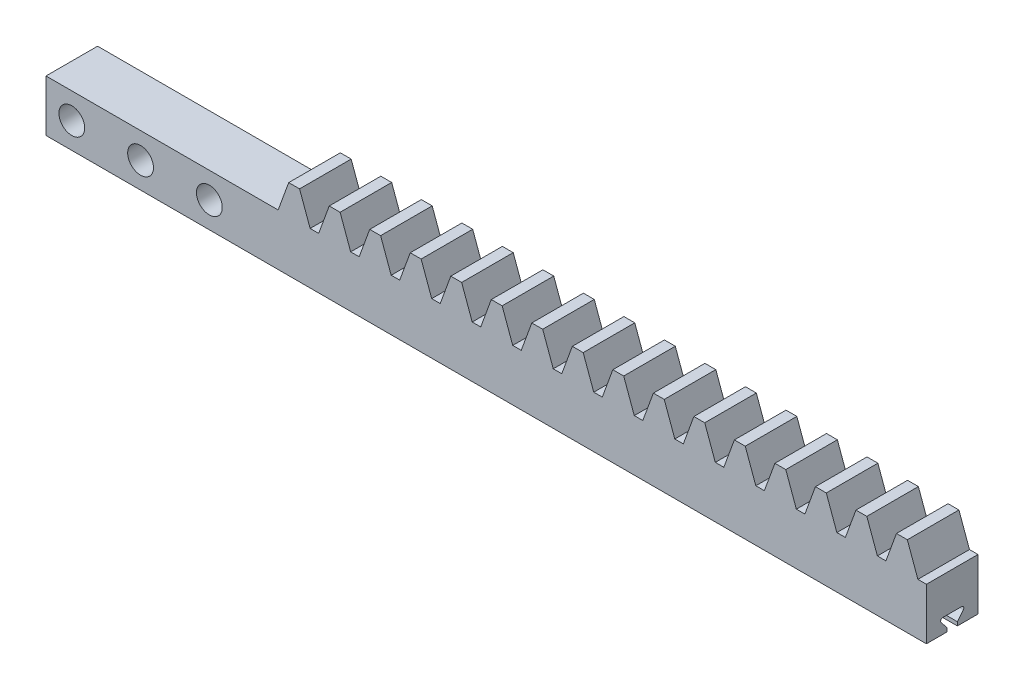
from build123d import *

# Parameters (mm, degrees)
SKETCH_1_W             = 94.247779608
SKETCH_1_H             = 6
EXTRUDE_1_DEPTH        = 6
EXTRUDE_2_DEPTH        = 6
PATTERN_LINEAR_1_COUNT = 20
PATTERN_LINEAR_1_PITCH = 4.71238898
SKETCH_4_W             = 27
SKETCH_4_H             = 6
SKETCH_4_R             = 1.5
EXTRUDE_1_2_DEPTH      = 6
CUT_EXTRUDE_1_DEPTH    = 10
CUT_EXTRUDE_START      = -24
CUT_EXTRUDE_2_DEPTH    = 79.74919082
FILLET_1_R             = 0.25


with BuildPart() as part:
    # 草图1 → Extrude 1 (new body)
    with BuildSketch(Plane.XY):
        with Locations((47.123889804, -3)):
            Rectangle(SKETCH_1_W, SKETCH_1_H)
    extrude(amount=EXTRUDE_1_DEPTH)

    # 草图2 → 拉伸2 (add)
    with BuildSketch(Plane.XY.offset(6)):
        Polygon((0, 0), (1.228399541, 3.375), (2.492683328, 3.375), (3.721082869, 0), align=None)
    extrude_2 = extrude(amount=-EXTRUDE_2_DEPTH)

    # 阵列(线性)1: 拉伸2 ×20
    with Locations(*[(i * PATTERN_LINEAR_1_PITCH, 0, 0) for i in range(1, PATTERN_LINEAR_1_COUNT)]):
        add(extrude_2)

    # 草图4 → Extrude 1 2 (add)
    with BuildSketch(Plane.XY.offset(6)):
        with Locations((-13.5, -3)):
            Rectangle(SKETCH_4_W, SKETCH_4_H)
        with Locations((-24, -3)):
            Circle(SKETCH_4_R, mode=Mode.SUBTRACT)
        with Locations((-16, -3)):
            Circle(SKETCH_4_R, mode=Mode.SUBTRACT)
        with Locations((-8, -3)):
            Circle(SKETCH_4_R, mode=Mode.SUBTRACT)
    extrude(amount=-EXTRUDE_1_2_DEPTH)

    # 草图5 → 切除-拉伸1 (cut)
    with BuildSketch(Plane.XY.offset(6)):
        Polygon((94.247779608, -6), (94.247779608, 6), (75.398223686, 6), (75.398223686, 0), (75.398223686, -6), align=None)
    extrude(amount=-CUT_EXTRUDE_1_DEPTH, mode=Mode.SUBTRACT)

    # 草图6 → 切除-拉伸2 (cut, through all)
    with BuildSketch(Plane.ZY.offset(27).offset(CUT_EXTRUDE_START)):
        Polygon((2.4, -5.570156212), (1.383875031, -4.3), (4.616124969, -4.3), (3.6, -5.570156212), (3.6, -6.2), (2.4, -6.2), align=None)
    extrude(amount=-CUT_EXTRUDE_2_DEPTH, mode=Mode.SUBTRACT)

    # 圆角1
    fillet_1_edges = [part.edges().sort_by_distance(p)[0] for p in [
        (36.199111843, -4.3, 1.383875031),
        (36.199111843, -4.3, 4.616124969),
    ]]
    fillet(fillet_1_edges, radius=FILLET_1_R)


solid = part.part
